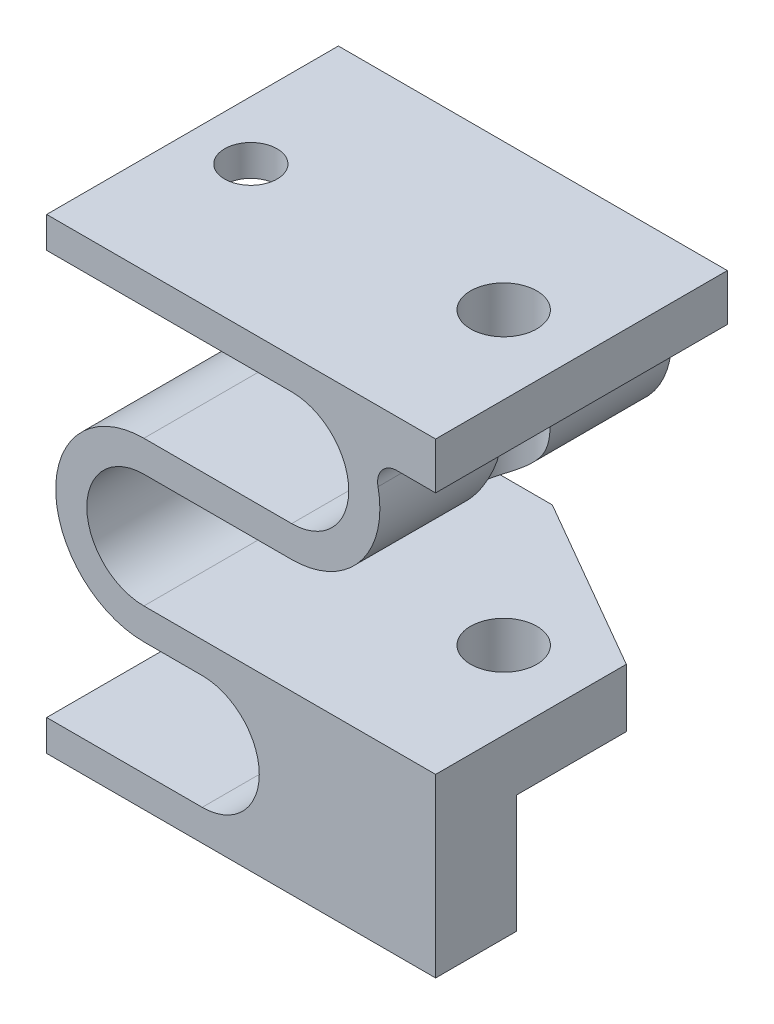
from build123d import *

# Parameters (mm, degrees)
BOSS_EXTRUDE1_DEPTH = 15
SKETCH2_R           = 1.7
CUT_EXTRUDE1_DEPTH  = 35.655960635
CUT_EXTRUDE2_DEPTH  = 6.066365529
CUT_EXTRUDE3_REACH  = 36.656
SKETCH4_R           = 1.35
CUT_EXTRUDE4_REACH  = 36.656
SKETCH5_R           = 1.350000001
CHAMFER2_SIZE       = 9
CHAMFER2_SIZE2      = 5.196152423


with BuildPart() as part:
    # Sketch1 → Boss-Extrude1 (new body)
    with BuildSketch(Plane.XY):
        with BuildLine():
            Line((0, 0), (20, 0))
            Line((20, 0), (20, 9.066365529))
            Line((20, 9.066365529), (8, 9.066365529))
            Line((8, 9.066365529), (5, 9.066365529))
            ThreePointArc((5, 9.066365529), (2.066666667, 11.999698862), (5, 14.933032196))
            Line((5, 14.933032196), (12.6, 14.933032196))
            ThreePointArc((12.6, 14.933032196), (16.118831006, 16.608004693), (17.03761247, 20.395292))
            ThreePointArc((17.03761247, 20.395292), (17.240267675, 21.230652218), (18.016414611, 21.600100131))
            Line((18.016414611, 21.600100131), (20, 21.600100131))
            Line((20, 21.600100131), (20, 24.000741841))
            Line((20, 24.000741841), (0, 24))
            Line((0, 24), (0, 22.4))
            Line((0, 22.4), (12.6, 22.4))
            ThreePointArc((12.6, 22.4), (15.533250224, 19.466749776), (12.6, 16.533499552))
            Line((12.6, 16.533499552), (5, 16.533499552))
            ThreePointArc((5, 16.533499552), (0.46628242, 11.999781972), (5, 7.466064391))
            Line((5, 7.466064391), (8, 7.466064391))
            ThreePointArc((8, 7.466064391), (10.933032196, 4.533032196), (8, 1.6))
            Line((8, 1.6), (0, 1.6))
            Line((0, 1.6), (0, 0))
        make_face()
    extrude(amount=BOSS_EXTRUDE1_DEPTH)

    # Sketch2 → Cut-Extrude1 (cut, through all)
    with BuildSketch(Plane(origin=(-0.000890209, 23.999999967, 0), x_dir=(0.9999999993120905, 3.709203365043046e-05, 0), z_dir=(-3.709203365043046e-05, 0.9999999993120905, 0))):
        with Locations(Location((16.000890209, -7.5, 0), (0, 0, 180))):
            Circle(SKETCH2_R)
    extrude(amount=-CUT_EXTRUDE1_DEPTH, mode=Mode.SUBTRACT)

    # Sketch3 → Cut-Extrude2 (cut)
    with BuildSketch(Plane.XZ):
        Polygon((21.085370845, -1.090112753), (21.085370845, 10.848631561), (16.00089022, 10.848631561), (13.10089022, 9.174315781), (13.10089022, -1.090112753), align=None)
    extrude(amount=-CUT_EXTRUDE2_DEPTH, mode=Mode.SUBTRACT)

    # Sketch4 → Cut-Extrude3 (cut, up to next)
    with BuildSketch(Plane(origin=(-0.000890209, 23.999999967, 0), x_dir=(0.9999999993120905, 3.709203365043046e-05, 0), z_dir=(-3.709203365043046e-05, 0.9999999993120905, 0)), mode=Mode.PRIVATE) as cut_extrude3_sk1:
        with Locations(Location((3.000890209, -7.5, 0), (0, 0, 180))):
            Circle(SKETCH4_R)
    cut_extrude3_tool1 = extrude(cut_extrude3_sk1.sketch, amount=-CUT_EXTRUDE3_REACH, mode=Mode.PRIVATE) & part.part
    add(cut_extrude3_tool1.solids().sort_by_distance((3, 24.000111, 7.5))[0], mode=Mode.SUBTRACT)

    # Sketch5 → Cut-Extrude4 (cut, up to next)
    with BuildSketch(Plane.XZ, mode=Mode.PRIVATE) as cut_extrude4_sk1:
        with Locations(Location((3.000059349, 7.5, 0), (0, 0, 270))):
            Circle(SKETCH5_R)
    cut_extrude4_tool1 = extrude(cut_extrude4_sk1.sketch, amount=-CUT_EXTRUDE4_REACH, mode=Mode.PRIVATE) & part.part
    add(cut_extrude4_tool1.solids().sort_by_distance((3.000059, 0, 7.5))[0], mode=Mode.SUBTRACT)

    # Chamfer2
    chamfer2_edges = [part.edges().sort_by_distance(p)[0] for p in [
        (20, 7.566365529, 0),
    ]]
    chamfer2_side = [part.faces().sort_by_distance(p)[0] for p in [
        (0.778698106, 11.999781972, 0),
    ]]
    chamfer(chamfer2_edges, length=CHAMFER2_SIZE, length2=CHAMFER2_SIZE2, reference=chamfer2_side[0])


solid = part.part
